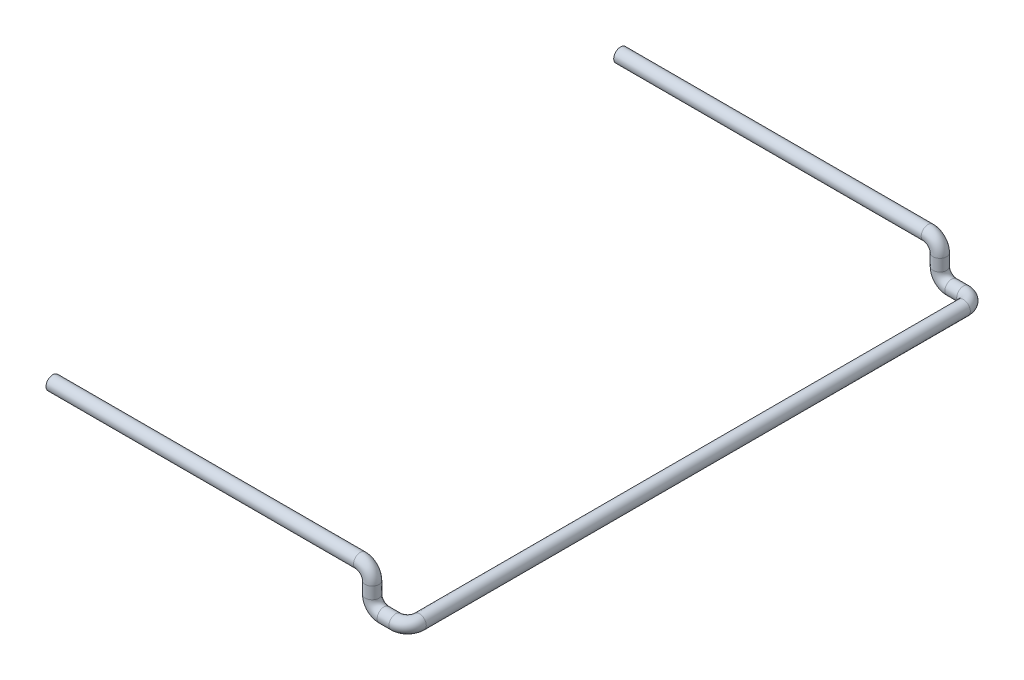
from build123d import *

# Parameters (mm, degrees)
SKETCH1_R = 2.87950634


with BuildPart() as part:
    # Sweep1: sweep along a curve in space
    with BuildLine() as sweep1_path:
        Line((0, 0, 0), (130, 0, 0))
        ThreePointArc((130, 0, 0), (133.535533906, -1.464466094, 0), (135, -5, 0))
        Line((135, -5, 0), (135, -10, 0))
        ThreePointArc((135, -10, 0), (136.464466094, -13.535533906, 0), (140, -15, 0))
        Line((140, -15, 0), (145, -15, 0))
        ThreePointArc((145, -15, 0), (148.535533906, -15, 1.464466094), (150, -15, 5))
        Line((150, -15, 5), (150, -15, 235))
        ThreePointArc((150, -15, 235), (148.535533906, -15, 238.535533906), (145, -15, 240))
        Line((145, -15, 240), (140, -15, 240))
        ThreePointArc((140, -15, 240), (136.464466094, -13.535533906, 240), (135, -10, 240))
        Line((135, -10, 240), (135, -5, 240))
        ThreePointArc((135, -5, 240), (133.535533906, -1.464466094, 240), (130, 0, 240))
        Line((130, 0, 240), (0, 0, 240))
    # Sketch1 → Sweep1 (sweep)
    with BuildSketch(Plane(origin=(0, 0, 0), x_dir=(0, 0, -1), z_dir=(1, 0, 0))):
        Circle(SKETCH1_R)
    sweep(path=sweep1_path.line)


solid = part.part
